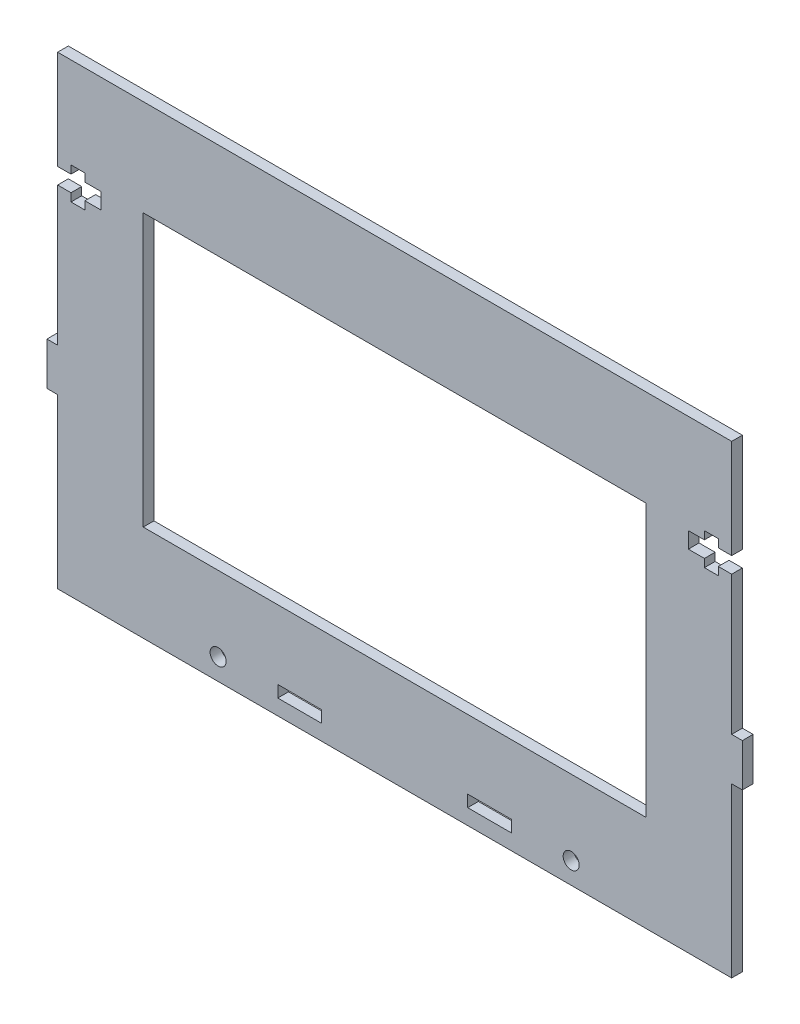
from build123d import *

# Parameters (mm, degrees)
SKETCH_1_R      = 1.5
SKETCH_1_W      = 8.2
SKETCH_1_H      = 2.2
SKETCH_1_W_2    = 94
SKETCH_1_H_2    = 50.875
EXTRUDE_1_DEPTH = 2


with BuildPart() as part:
    # 草图1 → 凸台-拉伸1 (new body)
    with BuildSketch(Plane.XY):
        Polygon((-62.766155614, -54.699512395), (-62.766155614, -53.199512395), (-65.266155614, -53.199512395), (-65.266155614, -79.137012395), (-67.266155614, -79.137012395), (-67.266155614, -87.137012395), (-65.266155614, -87.137012395), (-65.266155614, -118.574512395), (60.733844386, -118.574512395), (60.733844386, -87.137012395), (62.733844386, -87.137012395), (62.733844386, -79.137012395), (60.733844386, -79.137012395), (60.733844386, -53.199512395), (58.233844386, -53.199512395), (58.233844386, -54.699512395), (55.633844386, -54.699512395), (55.633844386, -53.199512395), (52.633844386, -53.199512395), (52.633844386, -50.199512395), (55.633844386, -50.199512395), (55.633844386, -48.699512395), (58.233844386, -48.699512395), (58.233844386, -50.199512395), (60.733844386, -50.199512395), (60.733844386, -31.699512395), (-65.266155614, -31.699512395), (-65.266155614, -50.199512395), (-62.766155614, -50.199512395), (-62.766155614, -48.699512395), (-60.166155614, -48.699512395), (-60.166155614, -50.199512395), (-57.166155614, -50.199512395), (-57.166155614, -53.199512395), (-60.166155614, -53.199512395), (-60.166155614, -54.699512395), align=None)
        with Locations((-35.266155614, -114.574512396)):
            Circle(SKETCH_1_R, mode=Mode.SUBTRACT)
        with Locations((-20.016155614, -114.574512396)):
            Rectangle(SKETCH_1_W, SKETCH_1_H, mode=Mode.SUBTRACT)
        with Locations((15.483844386, -114.574512396)):
            Rectangle(SKETCH_1_W, SKETCH_1_H, mode=Mode.SUBTRACT)
        with Locations((30.733844386, -114.574512396)):
            Circle(SKETCH_1_R, mode=Mode.SUBTRACT)
        with Locations((-2.266155614, -75.137012395)):
            Rectangle(SKETCH_1_W_2, SKETCH_1_H_2, mode=Mode.SUBTRACT)
    extrude(amount=EXTRUDE_1_DEPTH)


solid = part.part
